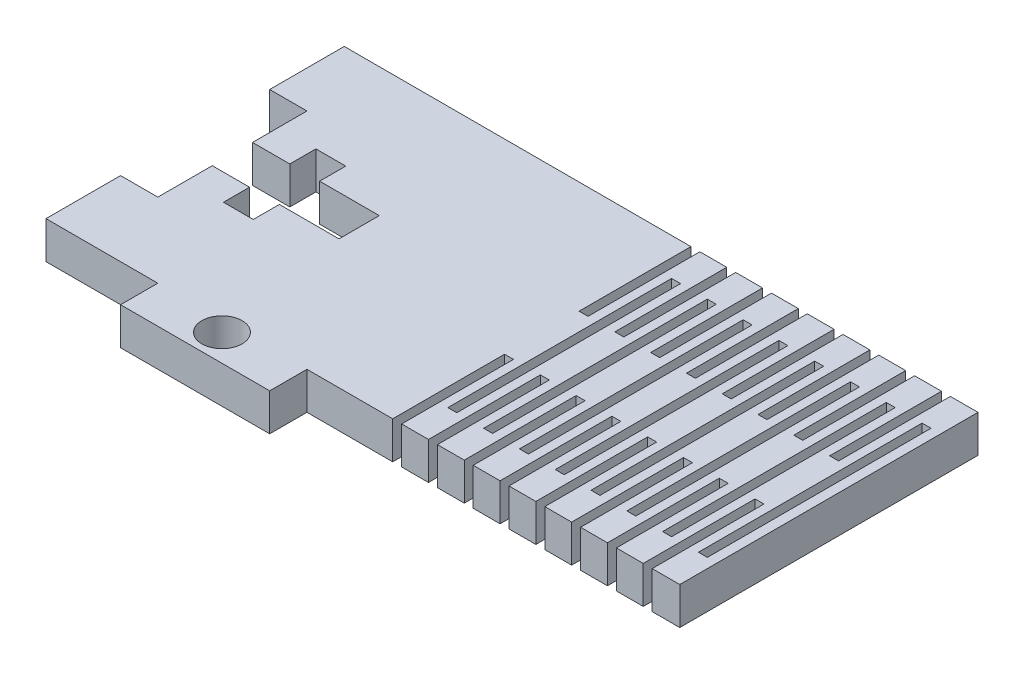
from build123d import *

# Parameters (mm, degrees)
SKETCH1_R           = 1.7145
BOSS_EXTRUDE1_DEPTH = 3.175
SKETCH3_W           = 25.4
SKETCH3_H           = 3.175
BOSS_EXTRUDE2_DEPTH = 25.4
SKETCH4_W           = 0.762
SKETCH4_H           = 9.525
SKETCH4_H_2         = 19.05
CUT_EXTRUDE2_DEPTH  = 60.737268518


with BuildPart() as part:
    # Sketch1 → Boss-Extrude1 (new body)
    with BuildSketch(Plane(origin=(0, 0, 0), x_dir=(1, 0, 0), z_dir=(0, 1, 0))):
        Polygon((0, 19.05), (3.175, 19.05), (3.175, 14.4145), (6.35, 14.4145), (6.35, 16.637), (8.89, 16.637), (8.89, 14.4145), (13.97, 14.4145), (13.97, 10.9855), (8.89, 10.9855), (8.89, 8.763), (6.35, 8.763), (6.35, 10.9855), (3.175, 10.9855), (3.175, 6.35), (0, 6.35), (0, 0), (9.525, 0), (9.525, -3.175), (22.225, -3.175), (22.225, 0), (28.575, 0), (28.575, 25.4), (0, 25.4), align=None)
        with Locations(Location((15.875, -0.889, 0), (0, 0, 270))):
            Circle(SKETCH1_R, mode=Mode.SUBTRACT)
    extrude(amount=BOSS_EXTRUDE1_DEPTH)

    # Sketch3 → Boss-Extrude2 (add)
    with BuildSketch(Plane(origin=(28.575, 0, 0), x_dir=(0, 0, -1), z_dir=(1, 0, 0))):
        with Locations((12.7, 1.5875)):
            Rectangle(SKETCH3_W, SKETCH3_H)
    extrude(amount=BOSS_EXTRUDE2_DEPTH)

    # Sketch4 → Cut-Extrude2 (cut, through all)
    with BuildSketch(Plane(origin=(0, 3.175, 0), x_dir=(1, 0, 0), z_dir=(0, 1, 0))):
        with Locations((29.908251949, 4.7625)):
            Rectangle(SKETCH4_W, SKETCH4_H)
        with Locations((31.432251949, 12.7)):
            Rectangle(SKETCH4_W, SKETCH4_H_2)
        with Locations((29.908251949, 20.6375)):
            Rectangle(SKETCH4_W, SKETCH4_H)
        with Locations((32.956251949, 4.7625)):
            Rectangle(SKETCH4_W, SKETCH4_H)
        with Locations((34.480251949, 12.7)):
            Rectangle(SKETCH4_W, SKETCH4_H_2)
        with Locations((32.956251949, 20.6375)):
            Rectangle(SKETCH4_W, SKETCH4_H)
        with Locations((36.004251949, 4.7625)):
            Rectangle(SKETCH4_W, SKETCH4_H)
        with Locations((37.528251949, 12.7)):
            Rectangle(SKETCH4_W, SKETCH4_H_2)
        with Locations((36.004251949, 20.6375)):
            Rectangle(SKETCH4_W, SKETCH4_H)
        with Locations((39.052251949, 4.7625)):
            Rectangle(SKETCH4_W, SKETCH4_H)
        with Locations((40.576251949, 12.7)):
            Rectangle(SKETCH4_W, SKETCH4_H_2)
        with Locations((39.052251949, 20.6375)):
            Rectangle(SKETCH4_W, SKETCH4_H)
        with Locations((42.100251949, 4.7625)):
            Rectangle(SKETCH4_W, SKETCH4_H)
        with Locations((43.624251949, 12.7)):
            Rectangle(SKETCH4_W, SKETCH4_H_2)
        with Locations((42.100251949, 20.6375)):
            Rectangle(SKETCH4_W, SKETCH4_H)
        with Locations((45.148251949, 4.7625)):
            Rectangle(SKETCH4_W, SKETCH4_H)
        with Locations((46.672251949, 12.7)):
            Rectangle(SKETCH4_W, SKETCH4_H_2)
        with Locations((45.148251949, 20.6375)):
            Rectangle(SKETCH4_W, SKETCH4_H)
        with Locations((48.196251949, 4.7625)):
            Rectangle(SKETCH4_W, SKETCH4_H)
        with Locations((49.720251949, 12.7)):
            Rectangle(SKETCH4_W, SKETCH4_H_2)
        with Locations((48.196251949, 20.6375)):
            Rectangle(SKETCH4_W, SKETCH4_H)
        with Locations((51.244251949, 4.7625)):
            Rectangle(SKETCH4_W, SKETCH4_H)
        with Locations((52.768251949, 12.7)):
            Rectangle(SKETCH4_W, SKETCH4_H_2)
        with Locations((51.244251949, 20.6375)):
            Rectangle(SKETCH4_W, SKETCH4_H)
    extrude(amount=-CUT_EXTRUDE2_DEPTH, mode=Mode.SUBTRACT)


solid = part.part
